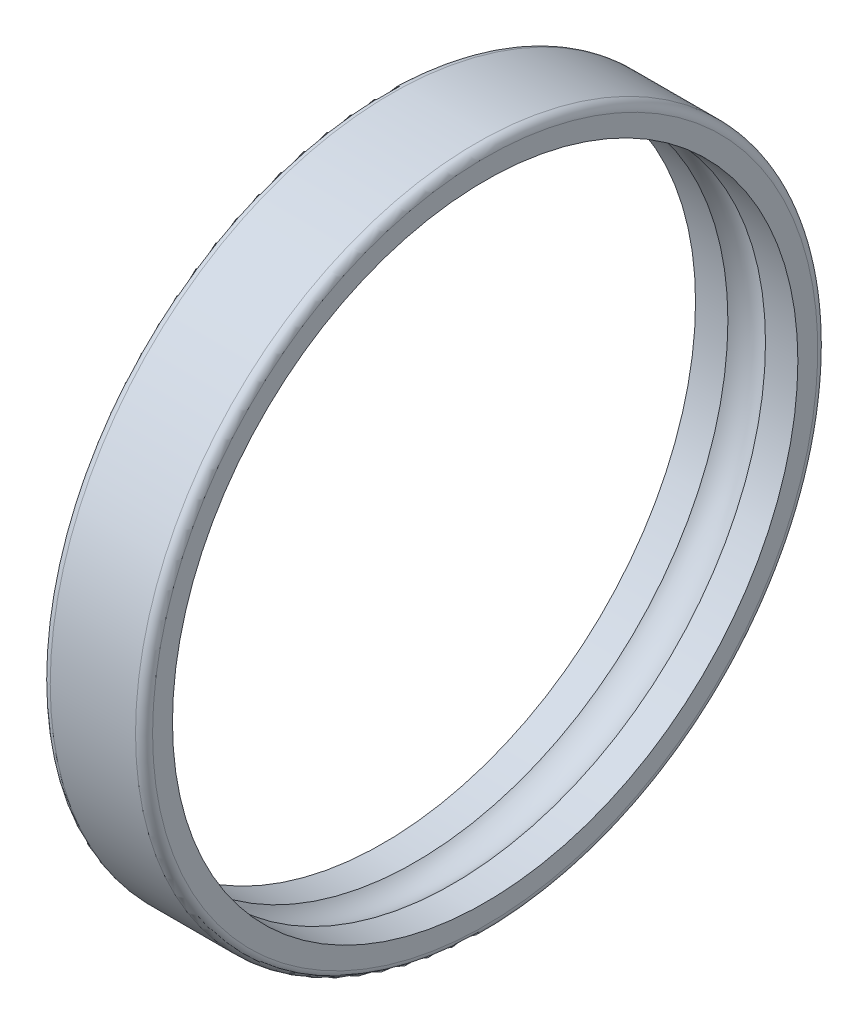
from build123d import *


with BuildPart() as part:
    # Esquisse1 → Base-Révolution (revolve)
    with BuildSketch(Plane.XY, mode=Mode.PRIVATE) as base_r_volution_sk:
        with BuildLine():
            Line((1.5, 60), (16.5, 60))
            ThreePointArc((16.5, 60), (17.560660172, 59.560660172), (18, 58.5))
            Line((18, 58.5), (18, 55))
            Line((18, 55), (12.307189139, 55))
            ThreePointArc((12.307189139, 55), (9, 56.25), (5.692810861, 55))
            Line((5.692810861, 55), (0, 55))
            Line((0, 55), (0, 58.5))
            ThreePointArc((0, 58.5), (0.439339828, 59.560660172), (1.5, 60))
        make_face()
    revolve(base_r_volution_sk.sketch.rotate(Axis((-7.787437811, 0, 0), (1, 0, 0)), 90), axis=Axis((-7.787437811, 0, 0), (1, 0, 0)))


solid = part.part
